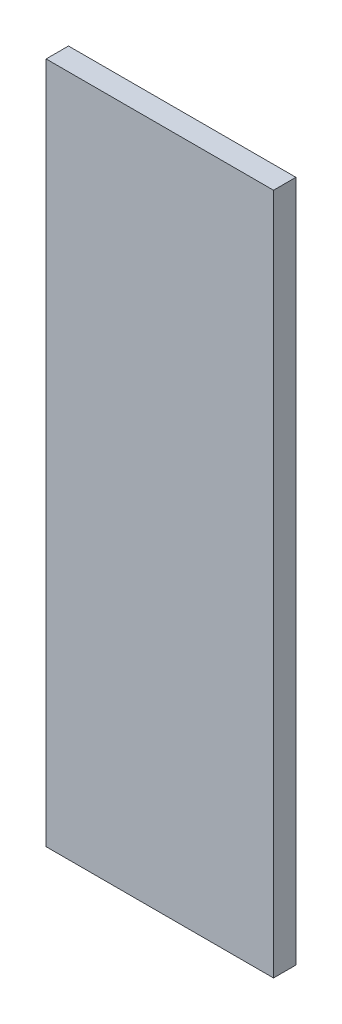
from build123d import *

# Parameters (mm, degrees)
SKETCH2_W           = 50.8
SKETCH2_H           = 152.4
BOSS_EXTRUDE1_DEPTH = 5


with BuildPart() as part:
    # Sketch2 → Boss-Extrude1 (new body)
    with BuildSketch(Plane.XY):
        with Locations((25.4, 0)):
            Rectangle(SKETCH2_W, SKETCH2_H)
    extrude(amount=BOSS_EXTRUDE1_DEPTH)


solid = part.part
